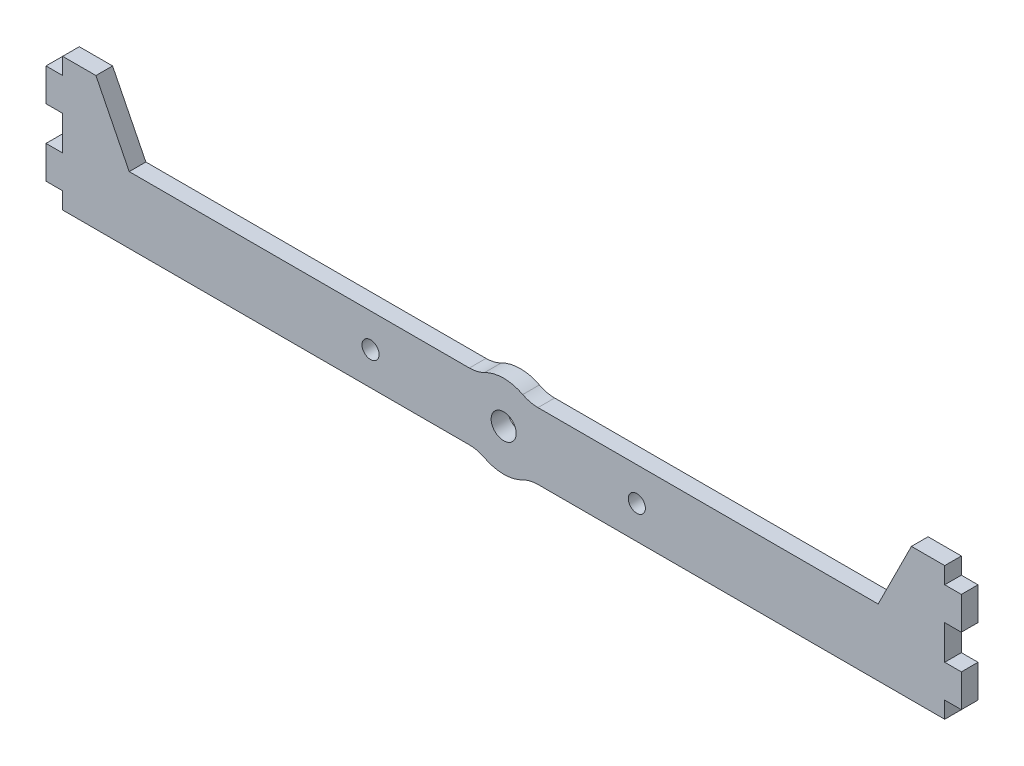
from build123d import *

# Parameters (mm, degrees)
BOSS_EXTRUDE1_DEPTH      = 6.35
V_0_377_DIAMETER_HOLE1_D = 9.5758
FILLET2_R                = 12.7
F_0_257_DIAMETER_HOLE1_D = 6.5278


with BuildPart() as part:
    # Sketch1 → Boss-Extrude1 (new body)
    with BuildSketch(Plane.XY):
        with BuildLine():
            Line((-168.275, -6.35), (-168.275, -12.7))
            Line((-168.275, -12.7), (-142.875, -12.7))
            Line((-142.875, -12.7), (-9.525, -12.7))
            ThreePointArc((-9.525, -12.7), (0, -15.875), (9.525, -12.7))
            Line((9.525, -12.7), (142.875, -12.7))
            Line((142.875, -12.7), (168.275, -12.7))
            Line((168.275, -12.7), (168.275, -6.35))
            Line((168.275, -6.35), (174.625, -6.35))
            Line((174.625, -6.35), (174.625, 6.15))
            Line((174.625, 6.15), (168.275, 6.15))
            Line((168.275, 6.15), (168.275, 12.7))
            Line((168.275, 12.7), (168.275, 19.25))
            Line((168.275, 19.25), (174.625, 19.25))
            Line((174.625, 19.25), (174.625, 31.75))
            Line((174.625, 31.75), (168.275, 31.75))
            Line((168.275, 31.75), (168.275, 38.1))
            Line((168.275, 38.1), (155.575, 38.1))
            Line((155.575, 38.1), (142.875, 12.7))
            Line((142.875, 12.7), (9.525, 12.7))
            ThreePointArc((9.525, 12.7), (0, 15.875), (-9.525, 12.7))
            Line((-9.525, 12.7), (-142.875, 12.7))
            Line((-142.875, 12.7), (-155.575, 38.1))
            Line((-155.575, 38.1), (-168.275, 38.1))
            Line((-168.275, 38.1), (-168.275, 31.75))
            Line((-168.275, 31.75), (-174.625, 31.75))
            Line((-174.625, 31.75), (-174.625, 19.25))
            Line((-174.625, 19.25), (-168.275, 19.25))
            Line((-168.275, 19.25), (-168.275, 12.7))
            Line((-168.275, 12.7), (-168.275, 6.15))
            Line((-168.275, 6.15), (-174.625, 6.15))
            Line((-174.625, 6.15), (-174.625, -6.35))
            Line((-174.625, -6.35), (-168.275, -6.35))
        make_face()
    extrude(amount=BOSS_EXTRUDE1_DEPTH)

    # V (0.377) Diameter Hole1 (through all)
    with Locations(Plane.XY.offset(6.35)):
        with Locations((0, 0)):
            Hole(V_0_377_DIAMETER_HOLE1_D / 2)

    # Fillet2
    fillet2_edges = [part.edges().sort_by_distance(p)[0] for p in [
        (-9.525, 12.7, 3.175),
        (9.525, 12.7, 3.175),
        (9.525, -12.7, 3.175),
        (-9.525, -12.7, 3.175),
    ]]
    fillet(fillet2_edges, radius=FILLET2_R)

    # F (0.257) Diameter Hole1 (through all)
    with Locations(Plane.XY.offset(6.35)):
        with Locations((-50.8, -0.1), (50.8, -0.1)):
            Hole(F_0_257_DIAMETER_HOLE1_D / 2)


solid = part.part
